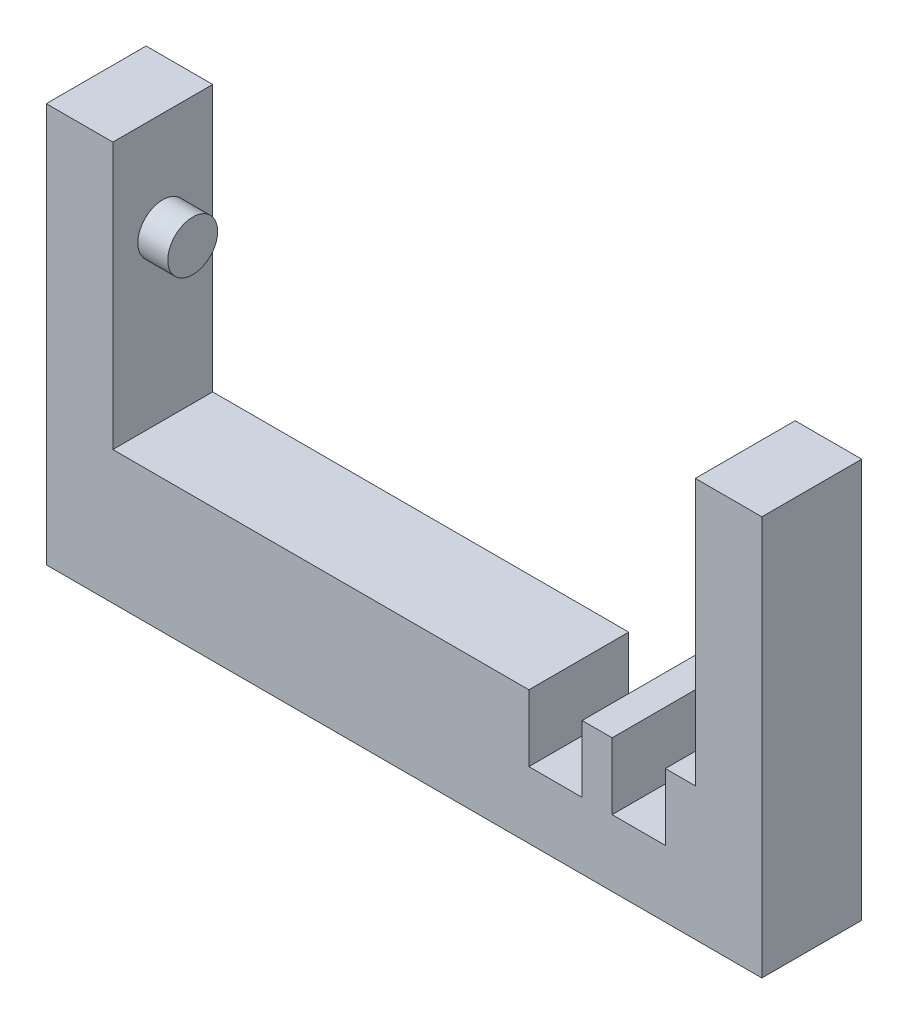
from build123d import *

# Parameters (mm, degrees)
SKETCH1_3_W           = 8
SKETCH1_3_H           = 15
BOSS_EXTRUDE2_DEPTH   = 10
BOSS_EXTRUDE2_2_DEPTH = 10
SKETCH1_W             = 4.5
SKETCH1_H             = 15
SKETCH1_W_2           = 62.5
BOSS_EXTRUDE3_DEPTH   = 20
SKETCH2_W             = 4.5
SKETCH2_H             = 5
BOSS_EXTRUDE5_DEPTH   = 5
SKETCH1_9_W           = 10
SKETCH1_9_H           = 15
BOSS_EXTRUDE6_DEPTH   = 60
SKETCH4_R             = 3.75
BOSS_EXTRUDE7_DEPTH   = 4.5
SKETCH5_R             = 1.5
CUT_EXTRUDE1_DEPTH    = 5


with BuildPart() as part:
    # Sketch1<3> → Boss-Extrude2 (new body)
    with BuildSketch(Plane(origin=(0, 0, 0), x_dir=(1, 0, 0), z_dir=(0, 1, 0))):
        with Locations((37.5, 0)):
            Rectangle(SKETCH1_3_W, SKETCH1_3_H)
    extrude(amount=BOSS_EXTRUDE2_DEPTH)



with BuildPart() as body_2:
    # Sketch1<3> → Boss-Extrude2 2 (new body)
    with BuildSketch(Plane(origin=(0, 0, 0), x_dir=(1, 0, 0), z_dir=(0, 1, 0))):
        with Locations((25, 0)):
            Rectangle(SKETCH1_3_W, SKETCH1_3_H)
    extrude(amount=BOSS_EXTRUDE2_2_DEPTH)


with BuildPart() as part_1:
    add(part.part)

    add(body_2.part)  # Boss-Extrude3 merges body 2
    # Sketch1 → Boss-Extrude3 (add)
    with BuildSketch(Plane(origin=(0, 0, 0), x_dir=(1, 0, 0), z_dir=(0, 1, 0))):
        with Locations((31.25, 0)):
            Rectangle(SKETCH1_W, SKETCH1_H)
        with Locations((43.75, 0)):
            Rectangle(SKETCH1_W, SKETCH1_H)
        with Locations((-10.25, 0)):
            Rectangle(SKETCH1_W_2, SKETCH1_H)
    extrude(amount=BOSS_EXTRUDE3_DEPTH)

    # Sketch2 → Boss-Extrude5 (add)
    with BuildSketch(Plane(origin=(0, 0, -7.5), x_dir=(-1, 0, 0), z_dir=(0, 0, -1))):
        with Locations((-31.25, 17.5)):
            Rectangle(SKETCH2_W, SKETCH2_H)
    extrude(amount=BOSS_EXTRUDE5_DEPTH)

    # Sketch1<9> → Boss-Extrude6 (add)
    with BuildSketch(Plane(origin=(0, 0, 0), x_dir=(1, 0, 0), z_dir=(0, 1, 0))):
        with Locations((51, 0)):
            Rectangle(SKETCH1_9_W, SKETCH1_9_H)
        with Locations((-46.5, 0)):
            Rectangle(SKETCH1_9_W, SKETCH1_9_H)
    extrude(amount=BOSS_EXTRUDE6_DEPTH)

    # Sketch4 → Boss-Extrude7 (add)
    with BuildSketch(Plane(origin=(-41.5, 0, 0), x_dir=(0, 0, -1), z_dir=(1, 0, 0))):
        with Locations((0, 45)):
            Circle(SKETCH4_R)
    extrude(amount=BOSS_EXTRUDE7_DEPTH)

    # Sketch5 → Cut-Extrude1 (cut)
    with BuildSketch(Plane(origin=(33.5, 0, 0), x_dir=(0, 0, -1), z_dir=(1, 0, 0))):
        with Locations((10, 17.5)):
            Circle(SKETCH5_R)
    extrude(amount=-CUT_EXTRUDE1_DEPTH, mode=Mode.SUBTRACT)


solid = part_1.part
